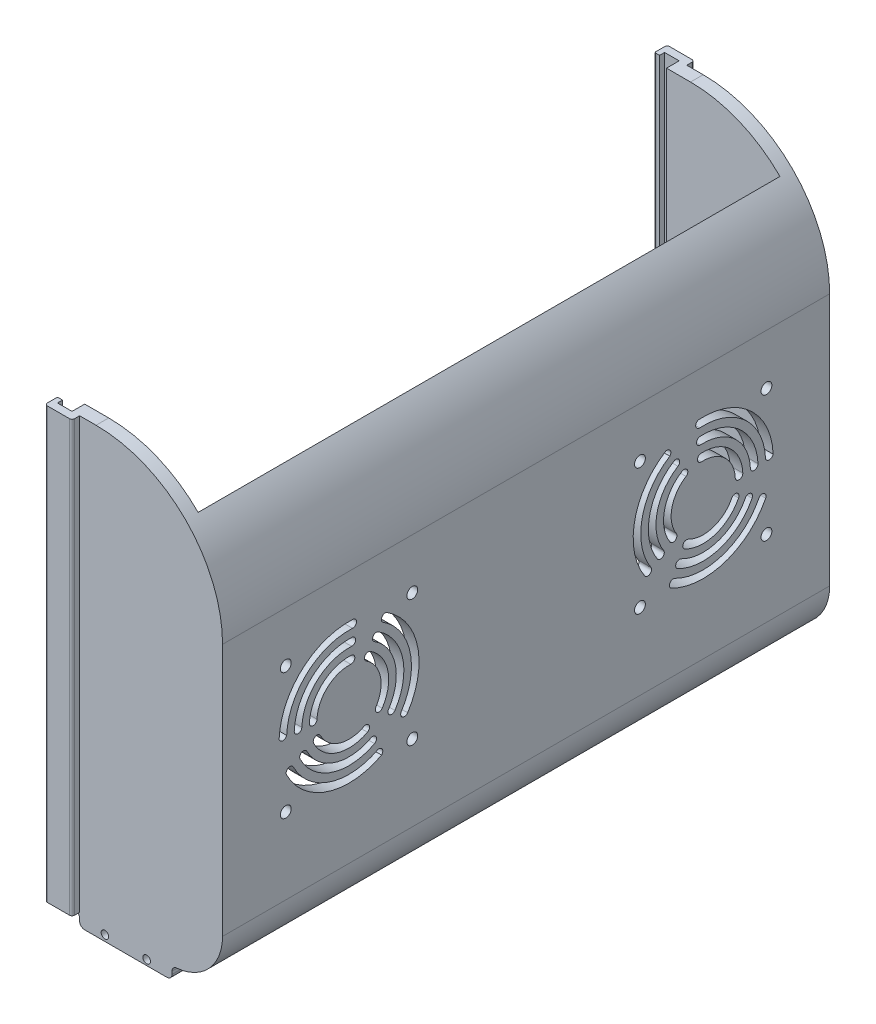
from build123d import *

# Parameters (mm, degrees)
BOSS_EXTRU_1_DEPTH      = 5
BOSS_EXTRU_3_DEPTH      = 230
BOSS_EXTRU_4_DEPTH      = 5
ESQUISSE4_R             = 2.150000000000492
ESQUISSE4_R_2           = 2.1500000000005186
ESQUISSE4_R_3           = 2.1500000000005204
ENL_V_MAT_EXTRU_1_DEPTH = 5
ENL_V_MAT_EXTRU_2_DEPTH = 5
ESQUISSE7_R             = 2.150000000000016
ESQUISSE7_R_2           = 2.149999999999988
ESQUISSE7_R_3           = 2.150000000000014
ENL_V_MAT_EXTRU_3_DEPTH = 5
ESQUISSE8_R             = 10.000000000000004
ENL_V_MAT_EXTRU_4_DEPTH = 5
ESQUISSE9_W             = 1.0000000000000362
ESQUISSE9_H             = 5.000000000000057
ESQUISSE9_W_2           = 1.0000000000000022
ESQUISSE9_H_2           = 5
ENL_V_MAT_EXTRU_5_DEPTH = 230.99999999999997
BOSS_EXTRU_5_DEPTH      = 170
ENL_V_MAT_EXTRU_6_DEPTH = 5
BOSS_EXTRU_6_DEPTH      = 5
CONG_1_R                = 2
ESQUISSE13_R            = 1.5000000000000009
ENL_V_MAT_EXTRU_7_DEPTH = 294.00000000000006


with BuildPart() as part:
    # Esquisse1 → Boss.-Extru.1 (new body)
    with BuildSketch(Plane.XY):
        with BuildLine():
            Line((-9.5e-16, 8.845311023870579), (9.99999999999971, 8.845311023870579))
            ThreePointArc((9.99999999999971, 8.845311023870579), (45.355339059327434, -5.7993499168020435), (60.000000000000064, -41.15468897612977))
            Line((60.000000000000064, -41.15468897612977), (60.00000000000008, -141.15468897612928))
            ThreePointArc((60.00000000000008, -141.15468897612928), (54.14213562373103, -155.29682459986037), (39.99999999999995, -161.15468897612942))
            Line((39.99999999999995, -161.15468897612942), (8.398e-14, -161.15468897612945))
            Line((8.398e-14, -161.15468897612945), (-9.5e-16, 8.845311023870579))
        make_face()
    extrude(amount=-BOSS_EXTRU_1_DEPTH)

    # Esquisse2 → Boss.-Extru.3 (add)
    with BuildSketch(Plane(origin=(0, 0, -5), x_dir=(-1, 0, 0), z_dir=(0, 0, -1))):
        with BuildLine():
            Line((-8.051e-14, -156.15468897612945), (-8.398e-14, -161.15468897612945))
            Line((-8.398e-14, -161.15468897612945), (-39.999999999999964, -161.15468897612942))
            ThreePointArc((-39.999999999999964, -161.15468897612942), (-54.142135623731036, -155.29682459986037), (-60.00000000000008, -141.15468897612928))
            Line((-60.00000000000008, -141.15468897612928), (-60.000000000000064, -41.15468897612975))
            ThreePointArc((-60.000000000000064, -41.15468897612975), (-56.19397662556445, -22.02051735787505), (-45.355339059327406, -5.7993499168020115))
            Line((-45.355339059327406, -5.7993499168020115), (-41.81980515339471, -9.33488382273477))
            ThreePointArc((-41.81980515339471, -9.33488382273477), (-51.57457896300804, -23.9339345197005), (-55.00000000000007, -41.15468897612968))
            Line((-55.00000000000007, -41.15468897612968), (-55.00000000000008, -141.1546889761293))
            ThreePointArc((-55.00000000000008, -141.1546889761293), (-50.60660171779831, -151.7612906939276), (-40.00000000000001, -156.15468897612942))
            Line((-40.00000000000001, -156.15468897612942), (-8.051e-14, -156.15468897612945))
        make_face()
    extrude(amount=BOSS_EXTRU_3_DEPTH)

    # Esquisse3 → Boss.-Extru.4 (add)
    with BuildSketch(Plane(origin=(0, 0, -235.00000000000003), x_dir=(-1, 0, 0), z_dir=(0, 0, -1))):
        with BuildLine():
            Line((-9.99999999999971, 8.845311023870579), (9.5e-16, 8.845311023870675))
            Line((9.5e-16, 8.845311023870675), (-8.398e-14, -161.15468897612945))
            Line((-8.398e-14, -161.15468897612945), (-39.999999999999964, -161.15468897612942))
            ThreePointArc((-39.999999999999964, -161.15468897612942), (-54.142135623731036, -155.29682459986037), (-60.00000000000008, -141.15468897612928))
            Line((-60.00000000000008, -141.15468897612928), (-60.000000000000064, -41.15468897612975))
            ThreePointArc((-60.000000000000064, -41.15468897612975), (-56.19397662556445, -22.02051735787505), (-45.355339059327406, -5.7993499168020115))
            ThreePointArc((-45.355339059327406, -5.7993499168020115), (-29.134171618254364, 5.039287649434996), (-9.99999999999971, 8.845311023870579))
        make_face()
    extrude(amount=BOSS_EXTRU_4_DEPTH)

    # Esquisse4 → Enlèv. mat.-Extru.1 (cut)
    with BuildSketch(Plane(origin=(60.00000000000006, 8.33e-15, 0), x_dir=(0, 0, -1), z_dir=(1, 1.4e-16, 0))):
        with Locations(Location((214.99999999999952, -60.99999999999985, 0), (0, 0, 90))):
            Circle(ESQUISSE4_R)
        with Locations(Location((214.99999999999952, -110.99999999999984, 0), (0, 0, 90))):
            Circle(ESQUISSE4_R)
        with Locations(Location((164.99999999999955, -110.99999999999984, 0), (0, 0, 90))):
            Circle(ESQUISSE4_R_2)
        with Locations(Location((164.99999999999955, -60.99999999999985, 0), (0, 0, 90))):
            Circle(ESQUISSE4_R_3)
    extrude(amount=-ENL_V_MAT_EXTRU_1_DEPTH, mode=Mode.SUBTRACT)

    # Esquisse6 → Enlèv. mat.-Extru.2 (cut)
    with BuildSketch(Plane(origin=(60.00000000000006, 8.33e-15, 0), x_dir=(0, 0, -1), z_dir=(1, 1.4e-16, 0))):
        with BuildLine():
            ThreePointArc((169.34719375799023, -99.50637109820285), (168.91279740912583, -101.58273807253416), (166.83643043479458, -101.14834172366955))
            ThreePointArc((166.83643043479458, -101.14834172366955), (162.95358124870774, -80.12510045117024), (175.20816995353988, -62.607159730897585))
            ThreePointArc((175.20816995353988, -62.607159730897585), (176.96581084742218, -63.27048068522312), (176.81149729300927, -65.1427743393328))
            ThreePointArc((176.81149729300927, -65.1427743393328), (165.88521732635888, -80.76189704994749), (169.34719375799023, -99.50637109820285))
        make_face()
        with BuildLine():
            ThreePointArc((174.36872040438223, -96.22242984726854), (173.93432405551786, -98.29879682159971), (171.85795708118667, -97.86440047273534))
            ThreePointArc((171.85795708118667, -97.86440047273534), (168.81685340400958, -81.39869364872405), (178.4148246324791, -67.67838894776703))
            ThreePointArc((178.4148246324791, -67.67838894776703), (180.4842956064314, -68.14453258224994), (180.01815197194853, -70.21400355620221))
            ThreePointArc((180.01815197194853, -70.21400355620221), (171.74848948166073, -82.03549024750122), (174.36872040438223, -96.22242984726854))
        make_face()
        with BuildLine():
            ThreePointArc((181.62147931141791, -72.74961816463743), (183.69095028537026, -73.21576179912032), (183.22480665088733, -75.28523277307261))
            ThreePointArc((183.22480665088733, -75.28523277307261), (177.61176163696277, -83.3090834450556), (179.39024705077347, -92.93848859633503))
            ThreePointArc((179.39024705077347, -92.93848859633503), (178.95585070190907, -95.01485557066621), (176.87948372757788, -94.5804592218018))
            ThreePointArc((176.87948372757788, -94.5804592218018), (174.68012555931188, -82.67228684627844), (181.62147931141791, -72.74961816463743))
        make_face()
        with BuildLine():
            ThreePointArc((205.66442762355888, -85.36917915523544), (204.22599990730814, -86.9283217738312), (202.6668572887124, -85.48989405758047))
            ThreePointArc((202.6668572887124, -85.48989405758047), (198.52452127756445, -76.61692914694471), (189.2959690863185, -73.34244011992514))
            ThreePointArc((189.2959690863185, -73.34244011992514), (187.71498071340082, -71.92805835933177), (189.12936247399432, -70.34706998641416))
            ThreePointArc((189.12936247399432, -70.34706998641416), (200.54182134797458, -74.39645612843671), (205.66442762355888, -85.36917915523544))
        make_face()
        with BuildLine():
            ThreePointArc((211.65956829325188, -85.12774935054539), (210.2211405770011, -86.68689196914119), (208.6619979584054, -85.24846425289041))
            ThreePointArc((208.6619979584054, -85.24846425289041), (202.55912141838473, -72.17598310992842), (188.96275586167008, -67.35169985290312))
            ThreePointArc((188.96275586167008, -67.35169985290312), (187.38176748875244, -65.9373180923097), (188.7961492493459, -64.35632971939211))
            ThreePointArc((188.7961492493459, -64.35632971939211), (204.57642148879486, -69.95551009142021), (211.65956829325188, -85.12774935054539))
        make_face()
        with BuildLine():
            ThreePointArc((214.6571386280984, -85.00703444820036), (206.59372155920502, -67.73503707291192), (188.62954263702164, -61.36095958588109))
            ThreePointArc((188.62954263702164, -61.36095958588109), (187.04855426410387, -59.94657782528768), (188.46293602469743, -58.36558945237005))
            ThreePointArc((188.46293602469743, -58.36558945237005), (208.61102162961518, -65.51456405440368), (217.6547089629449, -84.88631954585533))
            ThreePointArc((217.6547089629449, -84.88631954585533), (216.20143571869534, -86.07682073352501), (214.6571386280984, -85.00703444820036))
        make_face()
        with BuildLine():
            ThreePointArc((182.7140930650234, -99.88120268012668), (182.08304980732177, -97.85591642704793), (184.10833606040043, -97.22487316934652))
            ThreePointArc((184.10833606040043, -97.22487316934652), (193.86371708547247, -98.07398740799871), (201.31378386290822, -91.71907128373941))
            ThreePointArc((201.31378386290822, -91.71907128373941), (203.32916858469028, -91.05708607000153), (203.9911537984281, -93.0724707917836))
            ThreePointArc((203.9911537984281, -93.0724707917836), (194.77805309271378, -100.93125702528442), (182.7140930650234, -99.88120268012668))
        make_face()
        with BuildLine():
            ThreePointArc((181.31985006964624, -102.53753219090689), (195.6923890999547, -103.78852664256993), (206.6685237339479, -94.42587029982795))
            ThreePointArc((206.6685237339479, -94.42587029982795), (208.68390845572992, -93.76388508609006), (209.34589366946778, -95.77926980787211))
            ThreePointArc((209.34589366946778, -95.77926980787211), (196.60672510719576, -106.64579625985536), (179.92560707426918, -105.19386170168713))
            ThreePointArc((179.92560707426918, -105.19386170168713), (179.2945638165676, -103.16857544860846), (181.31985006964624, -102.53753219090689))
        make_face()
        with BuildLine():
            ThreePointArc((212.02326360498813, -97.13266931591761), (214.03864832677033, -96.47068410217975), (214.70063354050797, -98.48606882396194))
            ThreePointArc((214.70063354050797, -98.48606882396194), (198.4353971216779, -112.3603354944269), (177.13712108351547, -110.50652072324856))
            ThreePointArc((177.13712108351547, -110.50652072324856), (176.83275343388277, -108.65269858125332), (178.53136407889258, -107.85019121246832))
            ThreePointArc((178.53136407889258, -107.85019121246832), (197.52106111443695, -109.50306587714141), (212.02326360498813, -97.13266931591761))
        make_face()
    extrude(amount=-ENL_V_MAT_EXTRU_2_DEPTH, mode=Mode.SUBTRACT)

    # Esquisse7 → Enlèv. mat.-Extru.3 (cut)
    with BuildSketch(Plane(origin=(60.00000000000006, 8.33e-15, 0), x_dir=(0, 0, -1), z_dir=(1, 1.4e-16, 0))):
        with Locations(Location((74.99999999999999, -60.99999999999985, 0), (0, 0, 270))):
            Circle(ESQUISSE7_R)
        with Locations(Location((24.999999999999993, -60.99999999999985, 0), (0, 0, 270))):
            Circle(ESQUISSE7_R_2)
        with Locations(Location((24.999999999999993, -110.99999999999984, 0), (0, 0, 270))):
            Circle(ESQUISSE7_R_2)
        with Locations(Location((74.99999999999999, -110.99999999999984, 0), (0, 0, 270))):
            Circle(ESQUISSE7_R_3)
        with BuildLine():
            ThreePointArc((50.87063752600574, -70.34706998641414), (52.285019286599244, -71.92805835933179), (50.70403091368153, -73.34244011992512))
            ThreePointArc((50.70403091368153, -73.34244011992512), (41.47547872243562, -76.61692914694495), (37.33314271128766, -85.48989405758049))
            ThreePointArc((37.33314271128766, -85.48989405758049), (35.77400009269189, -86.9283217738312), (34.335572376441164, -85.36917915523546))
            ThreePointArc((34.335572376441164, -85.36917915523546), (39.45817865202547, -74.39645612843671), (50.87063752600574, -70.34706998641414))
        make_face()
        with BuildLine():
            ThreePointArc((64.79183004646019, -62.60715973089755), (77.04641875129235, -80.12510045117023), (73.16356956520478, -101.14834172366909))
            ThreePointArc((73.16356956520478, -101.14834172366909), (71.0872025908747, -101.58273807253345), (70.65280624200912, -99.5063710982024))
            ThreePointArc((70.65280624200912, -99.5063710982024), (74.1147826736412, -80.76189704994748), (63.1885027069908, -65.14277433933276))
            ThreePointArc((63.1885027069908, -65.14277433933276), (63.03418915257792, -63.270480685223134), (64.79183004646019, -62.60715973089755))
        make_face()
        with BuildLine():
            ThreePointArc((61.58517536752095, -67.67838894776705), (71.18314659599046, -81.39869364872406), (68.14204291881337, -97.86440047273535))
            ThreePointArc((68.14204291881337, -97.86440047273535), (66.06567594448215, -98.29879682159975), (65.63127959561783, -96.22242984726854))
            ThreePointArc((65.63127959561783, -96.22242984726854), (68.25151051833933, -82.0354902475012), (59.98184802805151, -70.2140035562022))
            ThreePointArc((59.98184802805151, -70.2140035562022), (59.51570439356867, -68.14453258224994), (61.58517536752095, -67.67838894776705))
        make_face()
        with BuildLine():
            ThreePointArc((58.37852068858213, -72.74961816463744), (65.31987444068815, -82.67228684627845), (63.12051627242216, -94.5804592218018))
            ThreePointArc((63.12051627242216, -94.5804592218018), (61.044149298091, -95.0148555706662), (60.609752949226575, -92.93848859633503))
            ThreePointArc((60.609752949226575, -92.93848859633503), (62.388238363037026, -83.30908344505562), (56.77519334911271, -75.28523277307261))
            ThreePointArc((56.77519334911271, -75.28523277307261), (56.309049714629836, -73.21576179912034), (58.37852068858213, -72.74961816463744))
        make_face()
        with BuildLine():
            ThreePointArc((31.33800204159465, -85.24846425289043), (37.44087858161532, -72.17598310992844), (51.03724413832997, -67.35169985290311))
            ThreePointArc((51.03724413832997, -67.35169985290311), (52.61823251124762, -65.93731809230971), (51.203850750654176, -64.35632971939211))
            ThreePointArc((51.203850750654176, -64.35632971939211), (35.42357851120518, -69.9555100914202), (28.34043170674816, -85.12774935054539))
            ThreePointArc((28.34043170674816, -85.12774935054539), (29.77885942299891, -86.68689196914113), (31.33800204159465, -85.24846425289043))
        make_face()
        with BuildLine():
            ThreePointArc((25.342861371901616, -85.00703444820034), (33.406278440795006, -67.73503707291191), (51.37045736297841, -61.360959585881076))
            ThreePointArc((51.37045736297841, -61.360959585881076), (52.95144573589618, -59.946577825287676), (51.53706397530261, -58.36558945237004))
            ThreePointArc((51.53706397530261, -58.36558945237004), (31.388978370384855, -65.51456405440368), (22.345291037055127, -84.88631954585533))
            ThreePointArc((22.345291037055127, -84.88631954585533), (23.798564281304735, -86.07682073352497), (25.342861371901616, -85.00703444820034))
        make_face()
        with BuildLine():
            ThreePointArc((62.8628789164846, -110.50652072324858), (41.56460287832213, -112.36033549442695), (25.29936645949227, -98.48606882396189))
            ThreePointArc((25.29936645949227, -98.48606882396189), (25.961351673229846, -96.47068410217997), (27.976736395012082, -97.13266931591754))
            ThreePointArc((27.976736395012082, -97.13266931591754), (42.47893888556307, -109.50306587714145), (61.46863592110746, -107.85019121246836))
            ThreePointArc((61.46863592110746, -107.85019121246836), (63.167246566117235, -108.65269858125335), (62.8628789164846, -110.50652072324858))
        make_face()
        with BuildLine():
            ThreePointArc((60.074392925730855, -105.19386170168713), (43.39327489280428, -106.64579625985536), (30.654106330532255, -95.77926980787211))
            ThreePointArc((30.654106330532255, -95.77926980787211), (31.316091544270122, -93.76388508608999), (33.33147626605215, -94.42587029982796))
            ThreePointArc((33.33147626605215, -94.42587029982796), (44.30761090004536, -103.78852664256992), (58.68014993035381, -102.53753219090687))
            ThreePointArc((58.68014993035381, -102.53753219090687), (60.705436183432454, -103.16857544860846), (60.074392925730855, -105.19386170168713))
        make_face()
        with BuildLine():
            ThreePointArc((57.28590693497665, -99.88120268012668), (45.22194690728628, -100.93125702528444), (36.00884620157196, -93.0724707917836))
            ThreePointArc((36.00884620157196, -93.0724707917836), (36.67083141530978, -91.05708607000153), (38.68621613709183, -91.71907128373941))
            ThreePointArc((38.68621613709183, -91.71907128373941), (46.13628291452729, -98.07398740799903), (55.891663939599574, -97.2248731693465))
            ThreePointArc((55.891663939599574, -97.2248731693465), (57.916950192678144, -97.85591642704799), (57.28590693497665, -99.88120268012668))
        make_face()
    extrude(amount=-ENL_V_MAT_EXTRU_3_DEPTH, mode=Mode.SUBTRACT)

    # Esquisse8 → Enlèv. mat.-Extru.4 (cut)
    with BuildSketch(Plane.XZ.offset(161.15468897612945)):
        with Locations((19.999999999999915, -200.0000000000001)):
            Circle(ESQUISSE8_R)
        with Locations((19.999999999999915, -170.0000000000001)):
            Circle(ESQUISSE8_R)
        with Locations((19.999999999999915, -140.0000000000001)):
            Circle(ESQUISSE8_R)
    extrude(amount=-ENL_V_MAT_EXTRU_4_DEPTH, mode=Mode.SUBTRACT)

    # Esquisse9 → Enlèv. mat.-Extru.5 (cut)
    with BuildSketch(Plane(origin=(8.439e-14, 8.845311023870675, 0), x_dir=(1, -3.99e-15, 0), z_dir=(3.99e-15, 1, 0))):
        with Locations((0.4999999999999819, 237.50000000000006)):
            Rectangle(ESQUISSE9_W, ESQUISSE9_H)
        with Locations((0.5000000000000011, 2.5)):
            Rectangle(ESQUISSE9_W_2, ESQUISSE9_H_2)
    extrude(amount=-ENL_V_MAT_EXTRU_5_DEPTH, mode=Mode.SUBTRACT)

    # Esquisse10 → Boss.-Extru.5 (add)
    with BuildSketch(Plane(origin=(8.439e-14, 8.845311023870675, 0), x_dir=(1, -3.99e-15, 0), z_dir=(3.99e-15, 1, 0))):
        with BuildLine():
            Line((2.499999999999956, 243.0000000000001), (-6.250000000000031, 243.0000000000001))
            ThreePointArc((-6.250000000000031, 243.0000000000001), (-6.9571067811865825, 242.70710678118667), (-7.250000000000037, 242.0000000000001))
            Line((-7.250000000000037, 242.0000000000001), (-7.2500000000000355, 238.5000000000001))
            ThreePointArc((-7.2500000000000355, 238.5000000000001), (-7.103553390593308, 238.14644660940684), (-6.750000000000032, 238.0000000000001))
            Line((-6.750000000000032, 238.0000000000001), (-5.250000000000036, 238.0000000000001))
            Line((-5.250000000000036, 238.0000000000001), (-5.250000000000036, 240.0000000000001))
            Line((-5.250000000000036, 240.0000000000001), (0.49999999999996403, 240.0000000000001))
            Line((0.49999999999996403, 240.0000000000001), (0.49999999999996436, 235.00000000000003))
            Line((0.49999999999996436, 235.00000000000003), (3.499999999999965, 235.00000000000003))
            Line((3.499999999999965, 235.00000000000003), (3.4999999999999636, 242.0000000000001))
            ThreePointArc((3.4999999999999636, 242.0000000000001), (3.2071067811865084, 242.70710678118667), (2.499999999999956, 243.0000000000001))
        make_face()
        with BuildLine():
            Line((0.4999999999999148, 5), (3.4999999999999147, 5))
            Line((3.4999999999999147, 5), (3.4999999999999156, -1.9999999999999167))
            ThreePointArc((3.4999999999999156, -1.9999999999999167), (3.207106781186463, -2.7071067811864644), (2.4999999999999156, -2.9999999999999165))
            Line((2.4999999999999156, -2.9999999999999165), (-6.250000000000085, -2.999999999999918))
            ThreePointArc((-6.250000000000085, -2.999999999999918), (-6.957106781186633, -2.7071067811864653), (-7.250000000000085, -1.9999999999999176))
            Line((-7.250000000000085, -1.9999999999999176), (-7.250000000000086, 1.500000000000082))
            ThreePointArc((-7.250000000000086, 1.500000000000082), (-7.10355339059336, 1.8535533905933557), (-6.750000000000086, 2.000000000000082))
            Line((-6.750000000000086, 2.000000000000082), (-5.250000000000086, 2.000000000000082))
            Line((-5.250000000000086, 2.000000000000082), (-5.250000000000086, 8.327e-14))
            Line((-5.250000000000086, 8.327e-14), (0.49999999999991457, 8.327e-14))
            Line((0.49999999999991457, 8.327e-14), (0.4999999999999148, 5))
        make_face()
    extrude(amount=-BOSS_EXTRU_5_DEPTH)

    # Esquisse11 → Enlèv. mat.-Extru.6 (cut)
    with BuildSketch(Plane.XZ.offset(161.15468897612945)):
        Polygon((-7.9105e-13, -235.00000000000003), (39.99999999999986, -235.00000000000003), (39.99999999999986, -5.000000000000004), (0, -5.000000000000004), align=None)
    extrude(amount=-ENL_V_MAT_EXTRU_6_DEPTH, mode=Mode.SUBTRACT)

    # Esquisse12 → Boss.-Extru.6 (add)
    with BuildSketch(Plane.XZ.offset(161.15468897612945)):
        Polygon((3.4999999999992113, 0), (3.4999999999992113, -5), (39.99999999999986, -5.000000000000004), (39.99999999999986, 0), align=None)
        Polygon((3.4999999999999396, -240.00000000000014), (3.4999999999998916, -235.00000000000003), (39.99999999999986, -235.00000000000003), (39.99999999999986, -240.00000000000014), align=None)
    extrude(amount=BOSS_EXTRU_6_DEPTH)

    # Congé1
    cong_1_edges = [part.edges().sort_by_distance(p)[0] for p in [
        (39.999999999999964, -161.15468897612942, -237.50000000000003),
        (39.99999999999995, -161.15468897612942, -2.5),
        (3.499999999999323, -161.15468897612945, -2.5),
        (39.99999999999997, -166.15468897612942, -2.500000000000002),
        (3.4999999999993268, -166.15468897612945, -2.5),
        (3.5000000000000275, -161.15468897612945, -237.50000000000009),
        (39.99999999999997, -166.15468897612942, -237.50000000000009),
        (3.500000000000031, -166.15468897612945, -237.50000000000009),
    ]]
    fillet(cong_1_edges, radius=CONG_1_R)

    # Esquisse13 → Enlèv. mat.-Extru.7 (cut)
    with BuildSketch(Plane(origin=(0, 1.959e-14, -240.0000000000001), x_dir=(-1, 0, 0), z_dir=(0, 8e-17, -1))):
        with Locations(Location((-13.49906186969164, -163.79166242639923, 0), (0, 0, 90))):
            Circle(ESQUISSE13_R)
        with Locations(Location((-29.99999999999997, -164.01770267475962, 0), (0, 0, 90))):
            Circle(ESQUISSE13_R)
    extrude(amount=-ENL_V_MAT_EXTRU_7_DEPTH, mode=Mode.SUBTRACT)


solid = part.part
